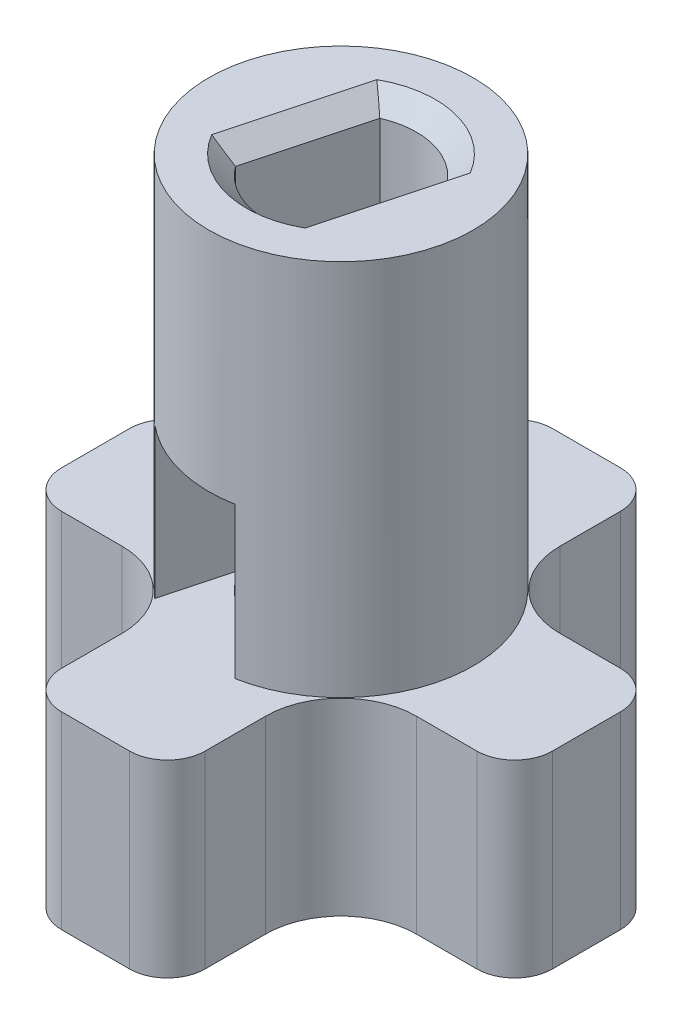
from build123d import *

# Parameters (mm, degrees)
SKETCH_1_R               = 3.5
EXTRUDE_1_DEPTH          = 15
EXTRUDE_2_DEPTH          = 5
CUT_EXTRUDE_1_DEPTH      = 15
CUT_EXTRUDE_2_DEPTH      = 15
CUT_EXTRUDE_2_DEPTH_BACK = 15
SKETCH_5_W               = 3
SKETCH_5_H               = 4
CHAMFER_1_SIZE           = 0.5


with BuildPart() as part:
    # 草图1 → 凸台-拉伸1 (new body)
    with BuildSketch(Plane(origin=(0, 0, 0), x_dir=(1, 0, 0), z_dir=(0, 1, 0))):
        Circle(SKETCH_1_R)
    extrude(amount=EXTRUDE_1_DEPTH)

    # 草图2 → 凸台-拉伸2 (add)
    with BuildSketch(Plane.XZ):
        with BuildLine():
            Line((0.9, 6.5), (-0.9, 6.5))
            ThreePointArc((-0.9, 6.5), (-1.607106781, 6.207106781), (-1.9, 5.5))
            Line((-1.9, 5.5), (-1.9, 3.9))
            ThreePointArc((-1.9, 3.9), (-2.485786438, 2.485786438), (-3.9, 1.9))
            Line((-3.9, 1.9), (-5.5, 1.9))
            ThreePointArc((-5.5, 1.9), (-6.207106781, 1.607106781), (-6.5, 0.9))
            Line((-6.5, 0.9), (-6.5, -0.9))
            ThreePointArc((-6.5, -0.9), (-6.207106781, -1.607106781), (-5.5, -1.9))
            Line((-5.5, -1.9), (-3.9, -1.9))
            ThreePointArc((-3.9, -1.9), (-2.485786438, -2.485786438), (-1.9, -3.9))
            Line((-1.9, -3.9), (-1.9, -5.5))
            ThreePointArc((-1.9, -5.5), (-1.607106781, -6.207106781), (-0.9, -6.5))
            Line((-0.9, -6.5), (0.9, -6.5))
            ThreePointArc((0.9, -6.5), (1.607106781, -6.207106781), (1.9, -5.5))
            Line((1.9, -5.5), (1.9, -3.9))
            ThreePointArc((1.9, -3.9), (2.485786438, -2.485786438), (3.9, -1.9))
            Line((3.9, -1.9), (5.5, -1.9))
            ThreePointArc((5.5, -1.9), (6.207106781, -1.607106781), (6.5, -0.9))
            Line((6.5, -0.9), (6.5, 0.9))
            ThreePointArc((6.5, 0.9), (6.207106781, 1.607106781), (5.5, 1.9))
            Line((5.5, 1.9), (3.9, 1.9))
            ThreePointArc((3.9, 1.9), (2.485786438, 2.485786438), (1.9, 3.9))
            Line((1.9, 3.9), (1.9, 5.5))
            ThreePointArc((1.9, 5.5), (1.607106781, 6.207106781), (0.9, 6.5))
        make_face()
    extrude(amount=-EXTRUDE_2_DEPTH)

    # 草图3 → 切除-拉伸1 (cut)
    with BuildSketch(Plane(origin=(0, 15, 0), x_dir=(1, 0, 0), z_dir=(0, 1, 0))):
        with BuildLine():
            Line((1.207407283, -0.323523806), (0.803326178, -1.831575019))
            ThreePointArc((0.803326178, -1.831575019), (-0.51763809, -1.931851653), (-1.611488388, -1.184527407))
            Line((-1.611488388, -1.184527407), (-1.207407283, 0.323523806))
            Line((-1.207407283, 0.323523806), (-0.803326178, 1.831575019))
            ThreePointArc((-0.803326178, 1.831575019), (0.51763809, 1.931851653), (1.611488388, 1.184527407))
            Line((1.611488388, 1.184527407), (1.207407283, -0.323523806))
        make_face()
    extrude(amount=-CUT_EXTRUDE_1_DEPTH, mode=Mode.SUBTRACT)

    # 草图5 → 切除-拉伸2 (cut, two sides: drawn at the far end of the back side and taken through both)
    with BuildSketch(Plane(origin=(0, 0, 0), x_dir=(-0.96592582628907, 0, -0.2588190451025146), z_dir=(0.2588190451025146, 0, -0.96592582628907)).offset(-CUT_EXTRUDE_2_DEPTH_BACK)):
        with Locations((0, 7)):
            Rectangle(SKETCH_5_W, SKETCH_5_H)
    extrude(amount=CUT_EXTRUDE_2_DEPTH + CUT_EXTRUDE_2_DEPTH_BACK, mode=Mode.SUBTRACT)

    # 倒角1
    chamfer_1_edges = [part.edges().sort_by_distance(p)[0] for p in [
        (1.207407283, 0, 0.323523806),
        (0.51763809, 0, -1.931851653),
        (-1.207407283, 0, -0.323523806),
        (-0.51763809, 0, 1.931851653),
        (-0.51763809, 15, 1.931851653),
        (-1.207407283, 15, -0.323523806),
        (0.51763809, 15, -1.931851653),
        (1.207407283, 15, 0.323523806),
    ]]
    chamfer(chamfer_1_edges, length=CHAMFER_1_SIZE)


solid = part.part
